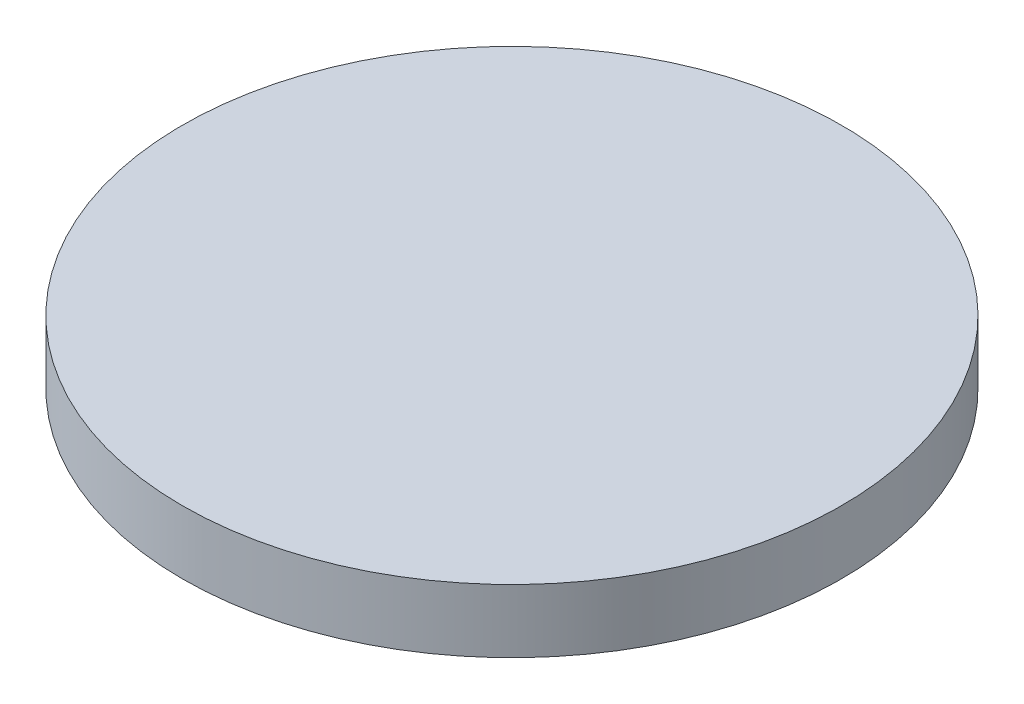
from build123d import *

# Parameters (mm, degrees)
SKETCH_2_R          = 6
SKETCH_2_R_2        = 1
EXTRUDE_1_DEPTH     = 2
SKETCH_3_R          = 3
EXTRUDE_2_DEPTH     = 3
SKETCH_4_R          = 8.25
EXTRUDE_3_DEPTH     = 6.4
FILLET_1_R          = 3
FILLET_2_R          = 0.5
SKETCH_5_R          = 1
CUT_EXTRUDE_3_DEPTH = 5
SKETCH_7_R          = 0.8
EXTRUDE_5_DEPTH     = 4
SKETCH_6_R          = 26
EXTRUDE_4_DEPTH     = 5


with BuildPart() as part:
    # 草图2 → 凸台-拉伸1 (new body)
    with BuildSketch(Plane(origin=(0, 0, 0), x_dir=(1, 0, 0), z_dir=(0, 1, 0))):
        with Locations(Location((0, 0, 0), (0, 0, 270))):
            Circle(SKETCH_2_R)
        with Locations(Location((0, 4.5, 0), (0, 0, 270))):
            Circle(SKETCH_2_R_2, mode=Mode.SUBTRACT)
        with Locations(Location((-4.5, 0, 0), (0, 0, 270))):
            Circle(SKETCH_2_R_2, mode=Mode.SUBTRACT)
        with Locations(Location((0, -4.5, 0), (0, 0, 90))):
            Circle(SKETCH_2_R_2, mode=Mode.SUBTRACT)
        with Locations(Location((4.5, 0, 0), (0, 0, 90))):
            Circle(SKETCH_2_R_2, mode=Mode.SUBTRACT)
    extrude(amount=EXTRUDE_1_DEPTH)

    # 草图3 → 凸台-拉伸2 (add)
    with BuildSketch(Plane(origin=(0, 2, 0), x_dir=(1, 0, 0), z_dir=(0, 1, 0))):
        with Locations(Location((0, 0, 0), (0, 0, 270))):
            Circle(SKETCH_3_R)
    extrude(amount=EXTRUDE_2_DEPTH)

    # 草图4 → 凸台-拉伸3 (add)
    with BuildSketch(Plane(origin=(0, 5, 0), x_dir=(1, 0, 0), z_dir=(0, 1, 0))):
        with Locations(Location((0, 0, 0), (0, 0, 270))):
            Circle(SKETCH_4_R)
    extrude(amount=EXTRUDE_3_DEPTH)

    # 圆角1
    fillet_1_edges = [part.edges().sort_by_distance(p)[0] for p in [
        (0, 11.4, -8.25),
    ]]
    fillet(fillet_1_edges, radius=FILLET_1_R)

    # 圆角2
    fillet_2_edges = [part.edges().sort_by_distance(p)[0] for p in [
        (0, 5, -8.25),
    ]]
    fillet(fillet_2_edges, radius=FILLET_2_R)

    # 草图5 → 切除-拉伸3 (cut)
    with BuildSketch(Plane(origin=(0, 11.4, 0), x_dir=(1, 0, 0), z_dir=(0, 1, 0))):
        with Locations(Location((0, 2.5, 0), (0, 0, 270))):
            Circle(SKETCH_5_R)
        with Locations(Location((2.5, 0, 0), (0, 0, 270))):
            Circle(SKETCH_5_R)
        with Locations(Location((0, -2.5, 0), (0, 0, 90))):
            Circle(SKETCH_5_R)
        with Locations(Location((-2.5, 0, 0), (0, 0, 90))):
            Circle(SKETCH_5_R)
    extrude(amount=-CUT_EXTRUDE_3_DEPTH, mode=Mode.SUBTRACT)

    # 草图7 → 凸台-拉伸5 (add)
    with BuildSketch(Plane(origin=(0, 11.4, 0), x_dir=(1, 0, 0), z_dir=(0, 1, 0))):
        with Locations(Location((0, 0, 0), (0, 0, 270))):
            Circle(SKETCH_7_R)
    extrude(amount=EXTRUDE_5_DEPTH)


with BuildPart() as body_2:
    # 草图6 → 凸台-拉伸4 (new body)
    with BuildSketch(Plane(origin=(0, 11.4, 0), x_dir=(1, 0, 0), z_dir=(0, 1, 0))):
        with Locations(Location((0, 0, 0), (0, 0, 270))):
            Circle(SKETCH_6_R)
    extrude(amount=EXTRUDE_4_DEPTH)


solid = Compound([part.part, body_2.part])
